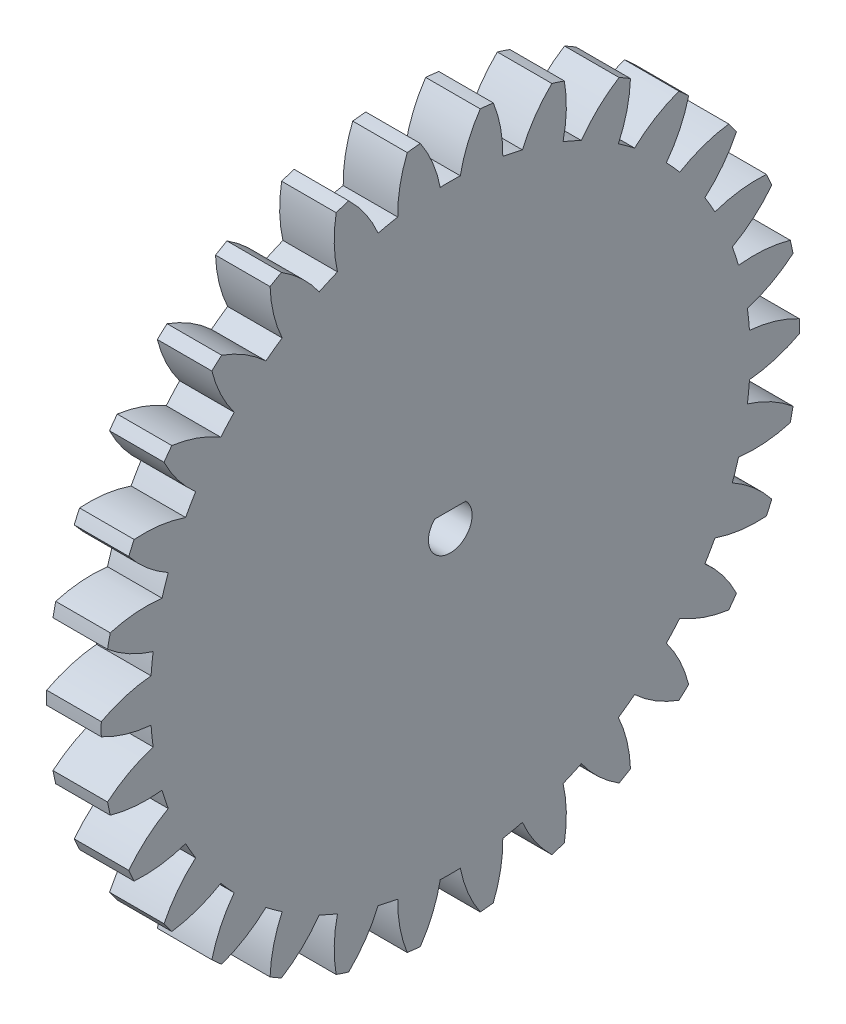
from build123d import *

# Parameters (mm, degrees)
BASPROSKE_W         = 5
BASPROSKE_H         = 32
TOOTHCUT_DEPTH      = 46.530209751
TEETHCUTS_COUNT     = 30
TEETHCUTS_ANGLE     = 348
BORSKE_R            = 2
BORE_DEPTH          = 50.0000508
BOSS_EXTRUDE1_DEPTH = 5


with BuildPart() as part:
    # BasProSke → Base-Revolve (revolve)
    with BuildSketch(Plane(origin=(0, 0, 0), x_dir=(1, 0, 0), z_dir=(0, 1, 0)), mode=Mode.PRIVATE) as base_revolve_sk:
        with Locations((2.5, 16)):
            Rectangle(BASPROSKE_W, BASPROSKE_H)
    revolve(base_revolve_sk.sketch.rotate(Axis((-10, 0, 0), (1, 0, 0)), 180), axis=Axis((-10, 0, 0), (1, 0, 0)))

    # TooCutSke → ToothCut (cut, through all)
    with BuildSketch(Plane(origin=(0, 0, 0), x_dir=(0, 0, -1), z_dir=(1, 0, 0))):
        with BuildLine():
            ThreePointArc((0.918551563, 27.483654488), (0, 27.499), (-0.918551563, 27.483654488))
            ThreePointArc((-0.918551563, 27.483654488), (-1.617208176, 29.787801627), (-2.761784709, 31.906093311))
            ThreePointArc((-2.761784709, 31.906093311), (0, 32.0254), (2.761784709, 31.906093311))
            ThreePointArc((2.761784709, 31.906093311), (1.617208176, 29.787801627), (0.918551563, 27.483654488))
        make_face()
    toothcut = extrude(amount=TOOTHCUT_DEPTH, mode=Mode.SUBTRACT)

    # TeethCuts: ToothCut ×30 about axis
    teethcuts_axis = Axis((-10, 0, 0), (1, 0, 0))
    for i in range(1, TEETHCUTS_COUNT):
        add(toothcut.rotate(teethcuts_axis, i * TEETHCUTS_ANGLE / (TEETHCUTS_COUNT - 1)), mode=Mode.SUBTRACT)

    # BorSke → Bore (cut, symmetric)
    with BuildSketch(Plane(origin=(0, 0, 0), x_dir=(0, 0, -1), z_dir=(1, 0, 0))):
        with Locations(Location((0, 0, 0), (0, 0, 180))):
            Circle(BORSKE_R)
    extrude(amount=BORE_DEPTH, both=True, mode=Mode.SUBTRACT)

    # Sketch1 → Boss-Extrude1 (add)
    with BuildSketch(Plane(origin=(5, 0, 0), x_dir=(0, 0, -1), z_dir=(1, 0, 0))):
        with BuildLine():
            Line((-1.428285686, 1.4), (1.428285686, 1.4))
            ThreePointArc((1.428285686, 1.4), (0, 2), (-1.428285686, 1.4))
        make_face()
    extrude(amount=-BOSS_EXTRUDE1_DEPTH)


solid = part.part
